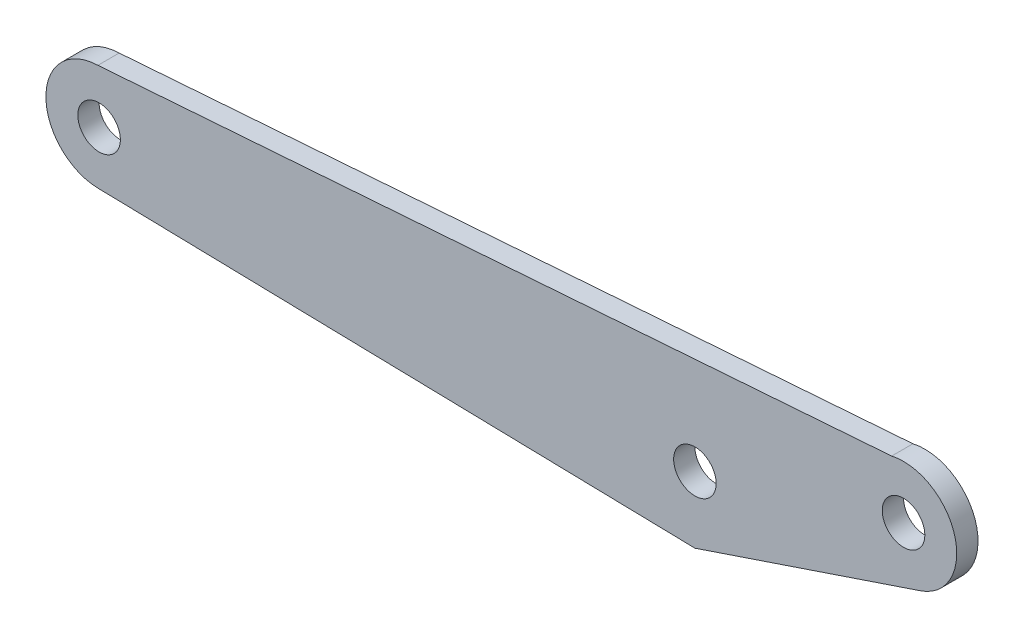
from build123d import *

# Parameters (mm, degrees)
CROQUIS1_R              = 4
SALIENTE_EXTRUIR1_DEPTH = 4


with BuildPart() as part:
    # Croquis1 → Saliente-Extruir1 (new body)
    # profile 1 of 2: a face of its own
    with BuildSketch(Plane.XY):
        with BuildLine():
            Line((0, -12.5), (42.408285537, 1.768055956))
            ThreePointArc((42.408285537, 1.768055956), (48.843358342, 13.962787444), (36.981350661, 20.992325968))
            Line((36.981350661, 20.992325968), (0, 12.5))
            Line((0, 12.5), (-112.222936903, 9.997514648))
            ThreePointArc((-112.222936903, 9.997514648), (-122, 0), (-112.222936903, -9.997514648))
            Line((-112.222936903, -9.997514648), (0, -12.5))
        make_face()
        with Locations((-112, 0)):
            Circle(CROQUIS1_R, mode=Mode.SUBTRACT)
        with Locations((39.219477194, 11.246004117)):
            Circle(CROQUIS1_R, mode=Mode.SUBTRACT)
        Circle(CROQUIS1_R, mode=Mode.SUBTRACT)
    # profile 2 of 2: a face of its own
    with BuildSketch(Plane.XY):
        Polygon((-112.222936903, 9.997514648), (36.981350661, 20.992325968), (0, 12.5), align=None)
    extrude(amount=SALIENTE_EXTRUIR1_DEPTH)


solid = part.part
